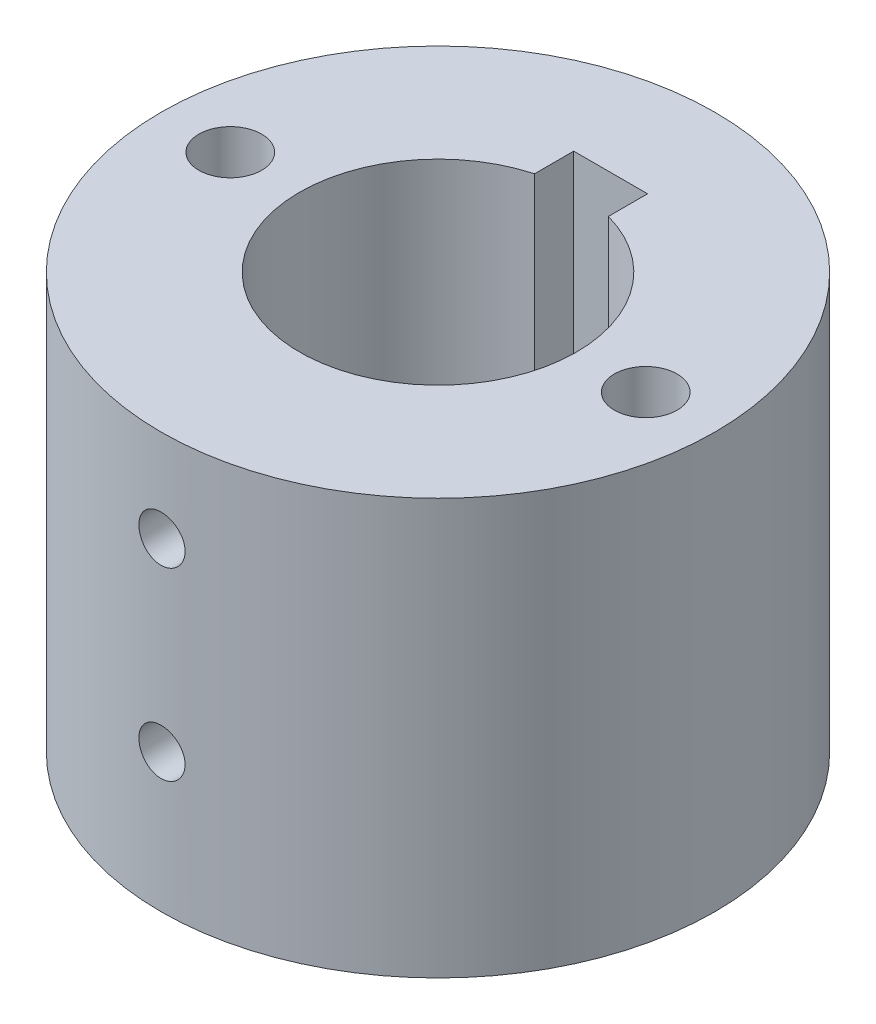
from build123d import *

# Parameters (mm, degrees)
SKETCH2_R           = 30
SKETCH2_R_2         = 15
BOSS_EXTRUDE1_DEPTH = 45
SKETCH5_R           = 3.4
CUT_EXTRUDE2_DEPTH  = 15
SKETCH7_R           = 2.5
CUT_EXTRUDE3_DEPTH  = 23
SKETCH8_W           = 8
SKETCH8_H           = 6
CUT_EXTRUDE4_DEPTH  = 62.846584554


with BuildPart() as part:
    # Sketch2 → Boss-Extrude1 (new body)
    with BuildSketch(Plane(origin=(0, 0, 0), x_dir=(1, 0, 0), z_dir=(0, 1, 0))):
        with Locations(Location((0, 0, 0), (0, 0, 90))):
            Circle(SKETCH2_R)
        with Locations(Location((0, 0, 0), (0, 0, 90))):
            Circle(SKETCH2_R_2, mode=Mode.SUBTRACT)
    extrude(amount=BOSS_EXTRUDE1_DEPTH)

    # Sketch5 → Cut-Extrude2 (cut)
    with BuildSketch(Plane(origin=(0, 45, 0), x_dir=(1, 0, 0), z_dir=(0, 1, 0))):
        with Locations(Location((22.5, 0, 0), (0, 0, 270))):
            Circle(SKETCH5_R)
        with Locations(Location((-22.5, 0, 0), (0, 0, 270))):
            Circle(SKETCH5_R)
    extrude(amount=-CUT_EXTRUDE2_DEPTH, mode=Mode.SUBTRACT)

    # Sketch7 → Cut-Extrude3 (cut)
    with BuildSketch(Plane.XY.offset(30)):
        with Locations((0, 35)):
            Circle(SKETCH7_R)
        with Locations((0, 15)):
            Circle(SKETCH7_R)
    extrude(amount=-CUT_EXTRUDE3_DEPTH, mode=Mode.SUBTRACT)

    # Sketch8 → Cut-Extrude4 (cut, through all)
    with BuildSketch(Plane(origin=(0, 45, 0), x_dir=(1, 0, 0), z_dir=(0, 1, 0))):
        with Locations((0, 15.7)):
            Rectangle(SKETCH8_W, SKETCH8_H)
    extrude(amount=-CUT_EXTRUDE4_DEPTH, mode=Mode.SUBTRACT)


solid = part.part
